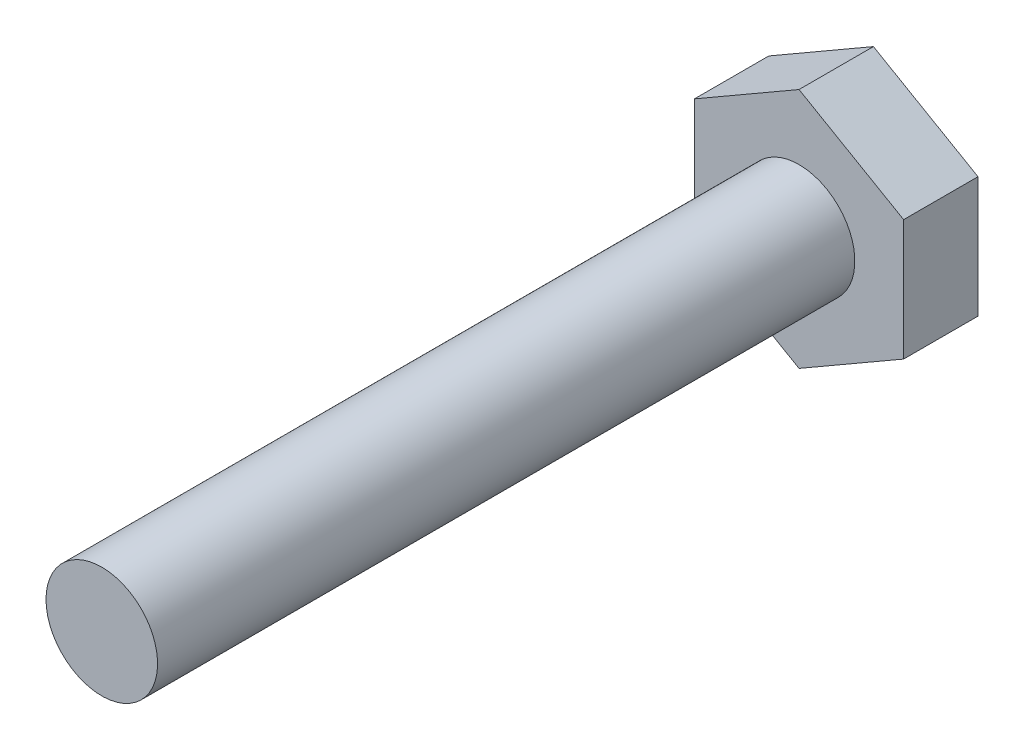
from build123d import *

# Parameters (mm, degrees)
BOSS_EXTRUDE1_DEPTH = 4.064
SKETCH2_R           = 3.048
BOSS_EXTRUDE2_DEPTH = 38.1


with BuildPart() as part:
    # Sketch1 → Boss-Extrude1 (new body)
    with BuildSketch(Plane.XY):
        Polygon((-5.715, 3.299556788), (-5.715, -3.299556788), (0, -6.599113577), (5.715, -3.299556788), (5.715, 3.299556788), (0, 6.599113577), align=None)
    extrude(amount=BOSS_EXTRUDE1_DEPTH)

    # Sketch2 → Boss-Extrude2 (add)
    with BuildSketch(Plane.XY.offset(4.064)):
        with Locations(Location((0, 0, 0), (0, 0, 180))):
            Circle(SKETCH2_R)
    extrude(amount=BOSS_EXTRUDE2_DEPTH)


solid = part.part
